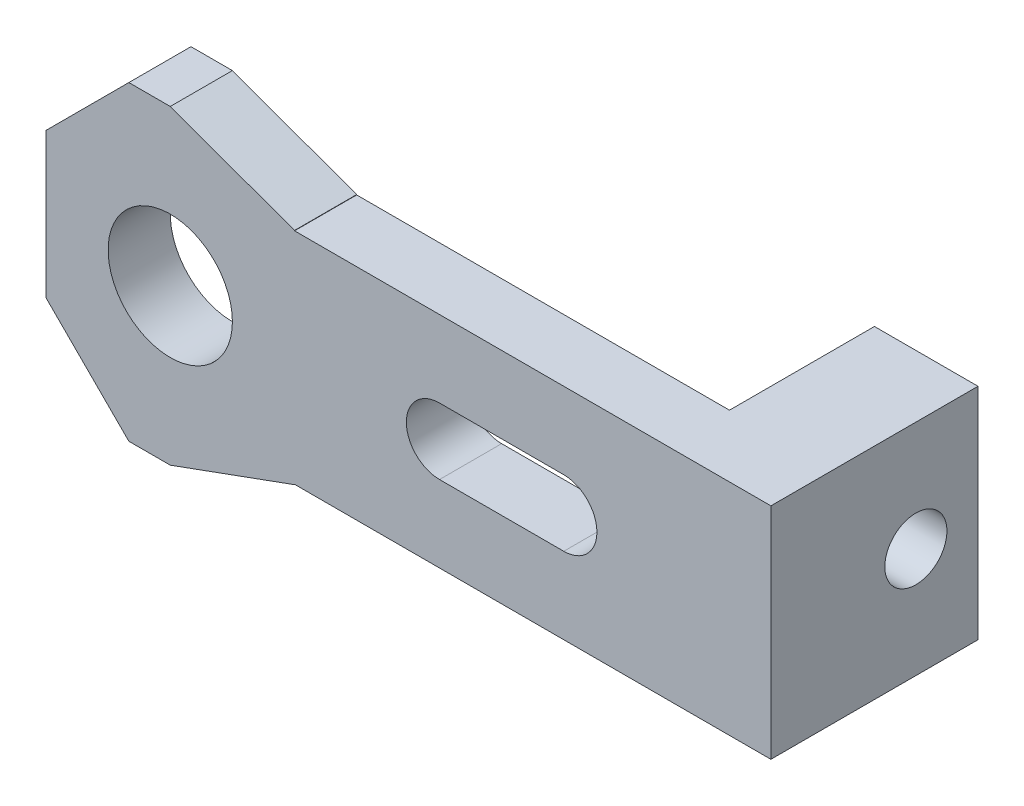
from build123d import *
from OCP.BRepFilletAPI import BRepFilletAPI_MakeChamfer

# Parameters (mm, degrees)
ESQUISSE1_W             = 35
ESQUISSE1_H             = 15
BOSS_EXTRU_1_DEPTH      = 3
ESQUISSE4_R             = 3
ENL_V_MAT_EXTRU_1_DEPTH = 39.19685851
CHANFREIN1_SIZE         = 4
ENL_V_MAT_EXTRU_2_DEPTH = 39.19685851
ESQUISSE6_W             = 5
ESQUISSE6_H             = 15
BOSS_EXTRU_2_DEPTH      = 7
ESQUISSE7_W             = 23
ESQUISSE7_H             = 2.2
ENL_V_MAT_EXTRU_3_DEPTH = 40.37003937
CHANFREIN2_SIZE         = 6
CHANFREIN2_SIZE2        = 2.183821406
ESQUISSE8_R             = 1.5
ENL_V_MAT_EXTRU_4_DEPTH = 7


with BuildPart() as part:
    # Esquisse1 → Boss.-Extru.1 (new body)
    with BuildSketch(Plane.XY):
        with Locations((17.5, 7.5)):
            Rectangle(ESQUISSE1_W, ESQUISSE1_H)
    extrude(amount=BOSS_EXTRU_1_DEPTH)

    # Esquisse4 → Enlèv. mat.-Extru.1 (cut, through all)
    with BuildSketch(Plane.XY.offset(3)):
        with Locations((6, 7.5)):
            Circle(ESQUISSE4_R)
    extrude(amount=-ENL_V_MAT_EXTRU_1_DEPTH, mode=Mode.SUBTRACT)

    # Chanfrein1
    chanfrein1_edges = [part.edges().sort_by_distance(p)[0] for p in [
        (0, 15, 1.5),
        (0, 0, 1.5),
    ]]
    chamfer(chanfrein1_edges, length=CHANFREIN1_SIZE)

    # Esquisse5 → Enlèv. mat.-Extru.2 (cut, through all)
    with BuildSketch(Plane(origin=(0, 0, 0), x_dir=(-1, 0, 0), z_dir=(0, 0, -1))):
        with BuildLine():
            Line((-19, 5.9), (-25, 5.9))
            ThreePointArc((-25, 5.9), (-26.6, 7.5), (-25, 9.1))
            Line((-25, 9.1), (-19, 9.1))
            ThreePointArc((-19, 9.1), (-17.4, 7.5), (-19, 5.9))
        make_face()
    extrude(amount=-ENL_V_MAT_EXTRU_2_DEPTH, mode=Mode.SUBTRACT)

    # Esquisse6 → Boss.-Extru.2 (add)
    with BuildSketch(Plane(origin=(0, 0, 0), x_dir=(-1, 0, 0), z_dir=(0, 0, -1))):
        with Locations((-32.5, 7.5)):
            Rectangle(ESQUISSE6_W, ESQUISSE6_H)
    extrude(amount=BOSS_EXTRU_2_DEPTH)

    # Esquisse7 → Enlèv. mat.-Extru.3 (cut, through all)
    with BuildSketch(Plane(origin=(0, 0, -7), x_dir=(-1, 0, 0), z_dir=(0, 0, -1))):
        with Locations((-23.5, 1.1)):
            Rectangle(ESQUISSE7_W, ESQUISSE7_H)
        with Locations((-23.5, 13.9)):
            Rectangle(ESQUISSE7_W, ESQUISSE7_H)
    extrude(amount=-ENL_V_MAT_EXTRU_3_DEPTH, mode=Mode.SUBTRACT)

    # Chanfrein2: one chamfer whose edges measure the first distance from different faces: ONE call of the kernel's chamfer builder (chamfer() names one face for all edges)
    chanfrein2_edges_1 = [part.edges().sort_by_distance(p)[0] for p in [
        (12, 0, 1.5),
    ]]
    chanfrein2_side_1 = [part.faces().sort_by_distance(p)[0] for p in [
        (8, 0, 1.5),
    ]]
    chanfrein2_edges_2 = [part.edges().sort_by_distance(p)[0] for p in [
        (12, 15, 1.5),
    ]]
    chanfrein2_side_2 = [part.faces().sort_by_distance(p)[0] for p in [
        (8, 15, 1.5),
    ]]
    chanfrein2 = BRepFilletAPI_MakeChamfer(part.part.solid().wrapped)
    for e in chanfrein2_edges_1:
        chanfrein2.Add(CHANFREIN2_SIZE, CHANFREIN2_SIZE2, e.wrapped, chanfrein2_side_1[0].wrapped)  # the first distance lies on this face
    for e in chanfrein2_edges_2:
        chanfrein2.Add(CHANFREIN2_SIZE, CHANFREIN2_SIZE2, e.wrapped, chanfrein2_side_2[0].wrapped)  # the first distance lies on this face
    add(Compound.cast(chanfrein2.Shape()), mode=Mode.REPLACE)

    # Esquisse8 → Enlèv. mat.-Extru.4 (cut)
    with BuildSketch(Plane.ZY.offset(-30)):
        with Locations((-4, 7.5)):
            Circle(ESQUISSE8_R)
    extrude(amount=-ENL_V_MAT_EXTRU_4_DEPTH, mode=Mode.SUBTRACT)


solid = part.part
